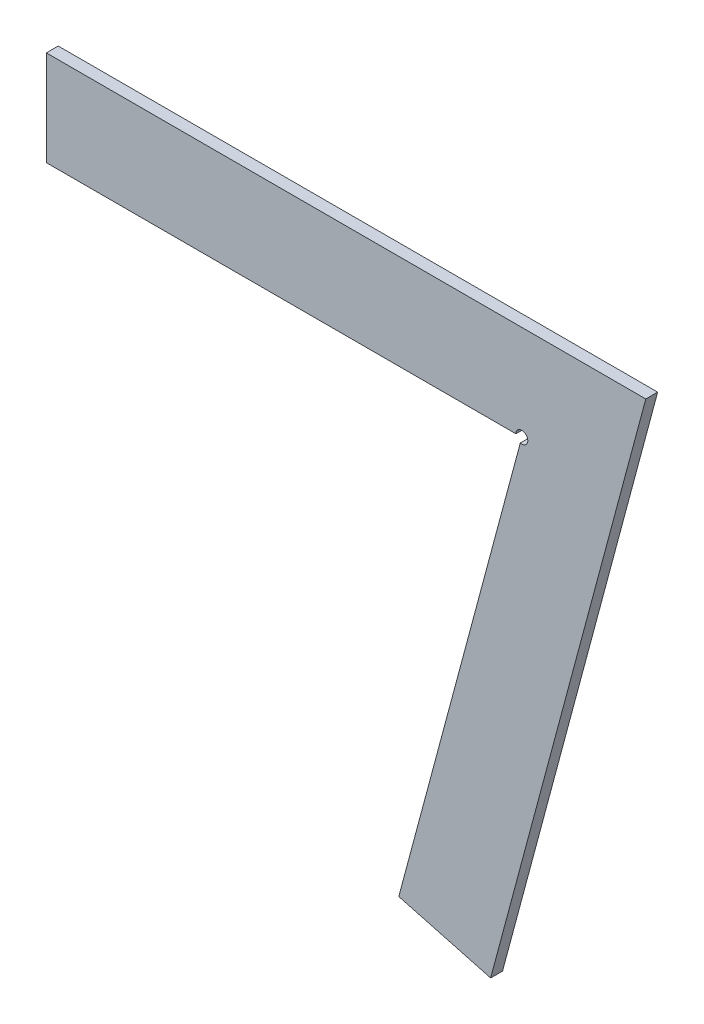
from build123d import *

# Parameters (mm, degrees)
BOSS_EXTRU_1_DEPTH      = 5
ESQUISSE2_R             = 2.5
ENL_V_MAT_EXTRU_1_DEPTH = 351.577754684


with BuildPart() as part:
    # Esquisse1 → Boss.-Extru.1 (new body)
    with BuildSketch(Plane.XY):
        Polygon((0, 0), (0, -40), (200, -40), (148.236190979, -233.185165258), (186.873224031, -243.537927062), (252.129014914, 0), align=None)
    extrude(amount=BOSS_EXTRU_1_DEPTH)

    # Esquisse2 → Enlèv. mat.-Extru.1 (cut, through all)
    with BuildSketch(Plane.XY.offset(5)):
        with Locations((200, -40)):
            Circle(ESQUISSE2_R)
    extrude(amount=-ENL_V_MAT_EXTRU_1_DEPTH, mode=Mode.SUBTRACT)


solid = part.part
